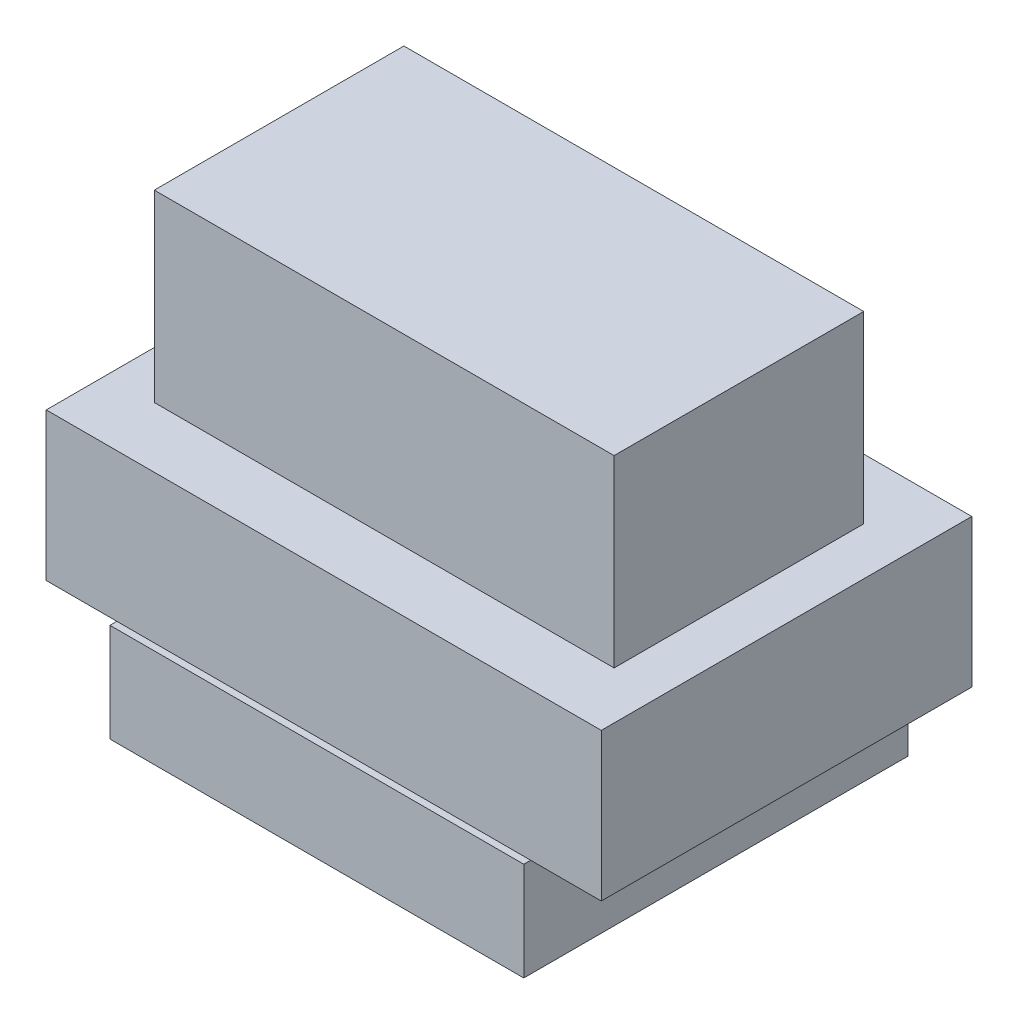
from build123d import *

# Parameters (mm, degrees)
SKETCH1_W           = 63
SKETCH1_H           = 58.5
BOSS_EXTRUDE1_DEPTH = 15
SKETCH2_W           = 84.5
SKETCH2_H           = 56.4
BOSS_EXTRUDE2_DEPTH = 22.5
SKETCH3_W           = 70
SKETCH3_H           = 38
BOSS_EXTRUDE3_DEPTH = 28


with BuildPart() as part:
    # Sketch1 → Boss-Extrude1 (new body)
    with BuildSketch(Plane(origin=(0, 0, 0), x_dir=(1, 0, 0), z_dir=(0, 1, 0))):
        Rectangle(SKETCH1_W, SKETCH1_H)
    extrude(amount=BOSS_EXTRUDE1_DEPTH)

    # Sketch2 → Boss-Extrude2 (add)
    with BuildSketch(Plane(origin=(0, 15, 0), x_dir=(1, 0, 0), z_dir=(0, 1, 0))):
        Rectangle(SKETCH2_W, SKETCH2_H)
    extrude(amount=BOSS_EXTRUDE2_DEPTH)

    # Sketch3 → Boss-Extrude3 (add)
    with BuildSketch(Plane(origin=(0, 37.5, 0), x_dir=(1, 0, 0), z_dir=(0, 1, 0))):
        Rectangle(SKETCH3_W, SKETCH3_H)
    extrude(amount=BOSS_EXTRUDE3_DEPTH)


solid = part.part
